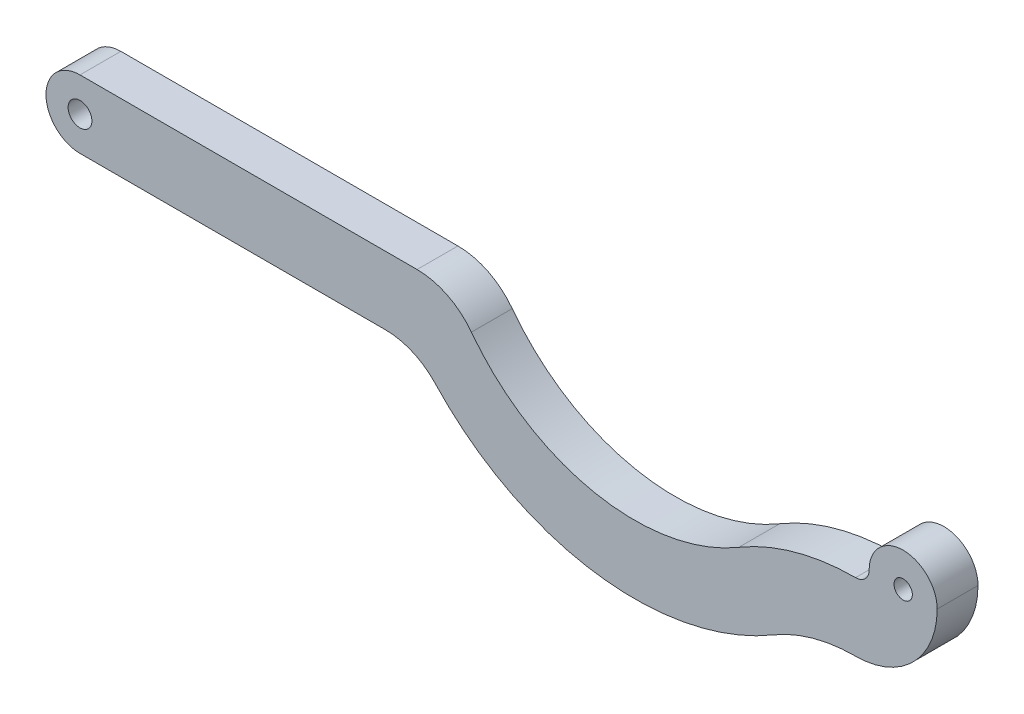
from build123d import *

# Parameters (mm, degrees)
ESQUISSE1_R        = 1.75
ESQUISSE1_R_2      = 1.35
BOSS_EXTRU_1_DEPTH = 6
CHANFREIN1_SIZE    = 1.25
CONG_1_R           = 10


with BuildPart() as part:
    # Esquisse1 → Boss.-Extru.1 (new body)
    with BuildSketch(Plane.XY):
        with BuildLine():
            Line((0, 0), (49.546865916, 0))
            ThreePointArc((49.546865916, 0), (73.776718043, -15.184943457), (101.953496658, -10.312840336))
            ThreePointArc((101.953496658, -10.312840336), (107.75313821, -7.843303604), (114.000000849, -7))
            ThreePointArc((114.000000849, -7), (122.485281675, -3.485281074), (126, 5))
            ThreePointArc((126, 5), (124.535533906, 8.535533906), (121, 10))
            ThreePointArc((121, 10), (117.464466094, 8.535533906), (116, 5))
            ThreePointArc((116, 5), (115.414213863, 3.585786738), (114.000000849, 3))
            ThreePointArc((114.000000849, 3), (105.101532849, 1.798737416), (96.840117389, -1.719043012))
            ThreePointArc((96.840117389, -1.719043012), (73.408662827, -4.825876336), (55, 10))
            Line((55, 10), (0, 10))
            ThreePointArc((0, 10), (-5, 5), (0, 0))
        make_face()
        with Locations((0, 5)):
            Circle(ESQUISSE1_R, mode=Mode.SUBTRACT)
        with Locations((121, 5)):
            Circle(ESQUISSE1_R_2, mode=Mode.SUBTRACT)
    extrude(amount=BOSS_EXTRU_1_DEPTH)

    # Chanfrein1
    chanfrein1_edges = [part.edges().sort_by_distance(p)[0] for p in [
        (-1.75, 5, 0),
        (119.65, 5, 0),
    ]]
    chamfer(chanfrein1_edges, length=CHANFREIN1_SIZE)

    # Congé1
    cong_1_edges = [part.edges().sort_by_distance(p)[0] for p in [
        (49.546865916, 0, 3),
        (55, 10, 3),
    ]]
    fillet(cong_1_edges, radius=CONG_1_R)


solid = part.part
